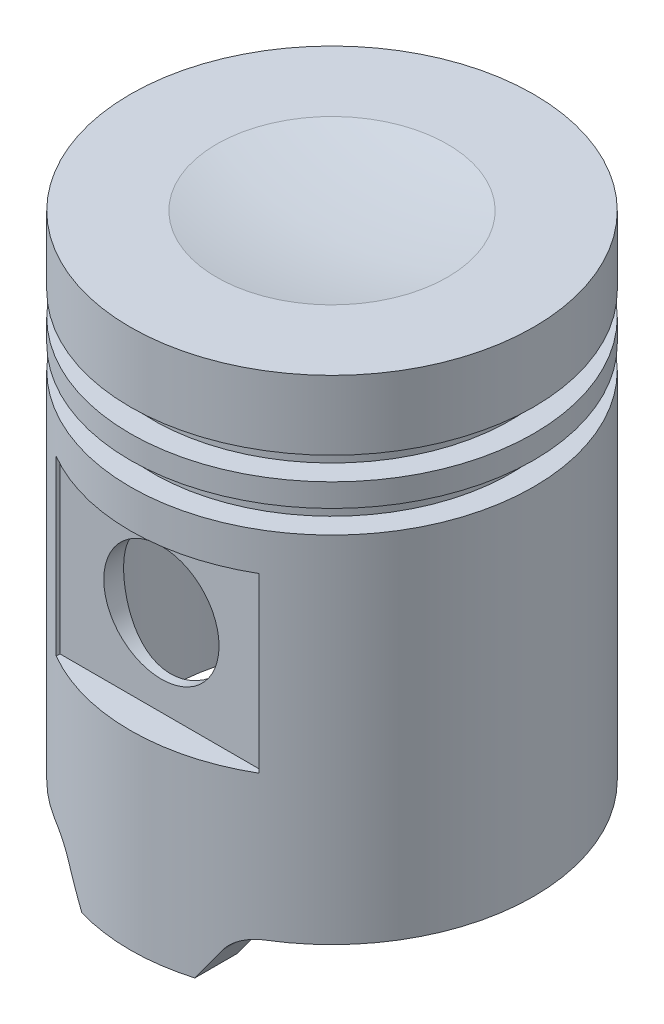
from build123d import *

# Parameters (mm, degrees)
SKETCH2_R               = 17.78
CUT_EXTRUDE1_DEPTH      = 51.816
CUT_EXTRUDE2_DEPTH      = 68.23495628
CUT_EXTRUDE2_DEPTH_BACK = 68.23495628
SKETCH3_R               = 6.35
CUT_EXTRUDE3_START      = -18.796
SKETCH4_W               = 22.352
SKETCH4_H               = 19.05
CUT_EXTRUDE3_DEPTH      = 49.438956346
CUT_EXTRUDE4_DEPTH      = 68.23495628


with BuildPart() as part:
    # Sketch1 → Revolve1 (revolve)
    with BuildSketch(Plane.XY, mode=Mode.PRIVATE) as revolve1_sk:
        with BuildLine():
            Line((0, 0), (22.225, 0))
            Line((22.225, 0), (22.225, 44.196))
            Line((22.225, 44.196), (19.685, 44.196))
            Line((19.685, 44.196), (19.685, 46.736))
            Line((19.685, 46.736), (22.225, 46.736))
            Line((22.225, 46.736), (22.225, 49.276))
            Line((22.225, 49.276), (19.685, 49.276))
            Line((19.685, 49.276), (19.685, 51.816))
            Line((19.685, 51.816), (22.225, 51.816))
            Line((22.225, 51.816), (22.225, 59.436))
            Line((22.225, 59.436), (12.712693656, 59.436))
            ThreePointArc((12.712693656, 59.436), (6.387986381, 58.484288237), (0, 58.166))
            Line((0, 58.166), (0, 0))
        make_face()
    revolve(revolve1_sk.sketch.rotate(Axis((0, 58.166, 0), (0, -1, 0)), 180), axis=Axis((0, 58.166, 0), (0, -1, 0)))

    # Sketch2 → Cut-Extrude1 (cut)
    with BuildSketch(Plane.XZ):
        Circle(SKETCH2_R)
    extrude(amount=-CUT_EXTRUDE1_DEPTH, mode=Mode.SUBTRACT)

    # Sketch3 → Cut-Extrude2 (cut, two sides: drawn at the far end of the back side and taken through both)
    with BuildSketch(Plane.XY.offset(-CUT_EXTRUDE2_DEPTH_BACK)):
        with Locations((0, 30.48)):
            Circle(SKETCH3_R)
    extrude(amount=CUT_EXTRUDE2_DEPTH + CUT_EXTRUDE2_DEPTH_BACK, mode=Mode.SUBTRACT)

    # Sketch4 → Cut-Extrude3 (cut, through all)
    with BuildSketch(Plane.XY.offset(CUT_EXTRUDE3_START)):
        with Locations((0, 30.48)):
            Rectangle(SKETCH4_W, SKETCH4_H)
    cut_extrude3 = extrude(amount=-CUT_EXTRUDE3_DEPTH, mode=Mode.SUBTRACT)

    # Mirror1: Cut-Extrude3 across plane
    add(cut_extrude3.mirror(Plane.XY), mode=Mode.SUBTRACT)

    # Sketch5 → Cut-Extrude4 (cut, symmetric)
    with BuildSketch(Plane.XY):
        with BuildLine():
            Line((6.223, 0), (8.503897348, 3.420061294))
            ThreePointArc((8.503897348, 3.420061294), (9.876155028, 4.665440061), (11.673642553, 5.116104025))
            Line((11.673642553, 5.116104025), (22.225, 5.116104025))
            Line((22.225, 5.116104025), (22.225, 0))
            Line((22.225, 0), (6.223, 0))
        make_face()
    cut_extrude4 = extrude(amount=CUT_EXTRUDE4_DEPTH, both=True, mode=Mode.SUBTRACT)

    # Mirror2: Cut-Extrude4 across plane
    add(cut_extrude4.mirror(Plane(origin=(0, 0, 0), x_dir=(0, 0, 1), z_dir=(1, 0, 0))), mode=Mode.SUBTRACT)


solid = part.part
